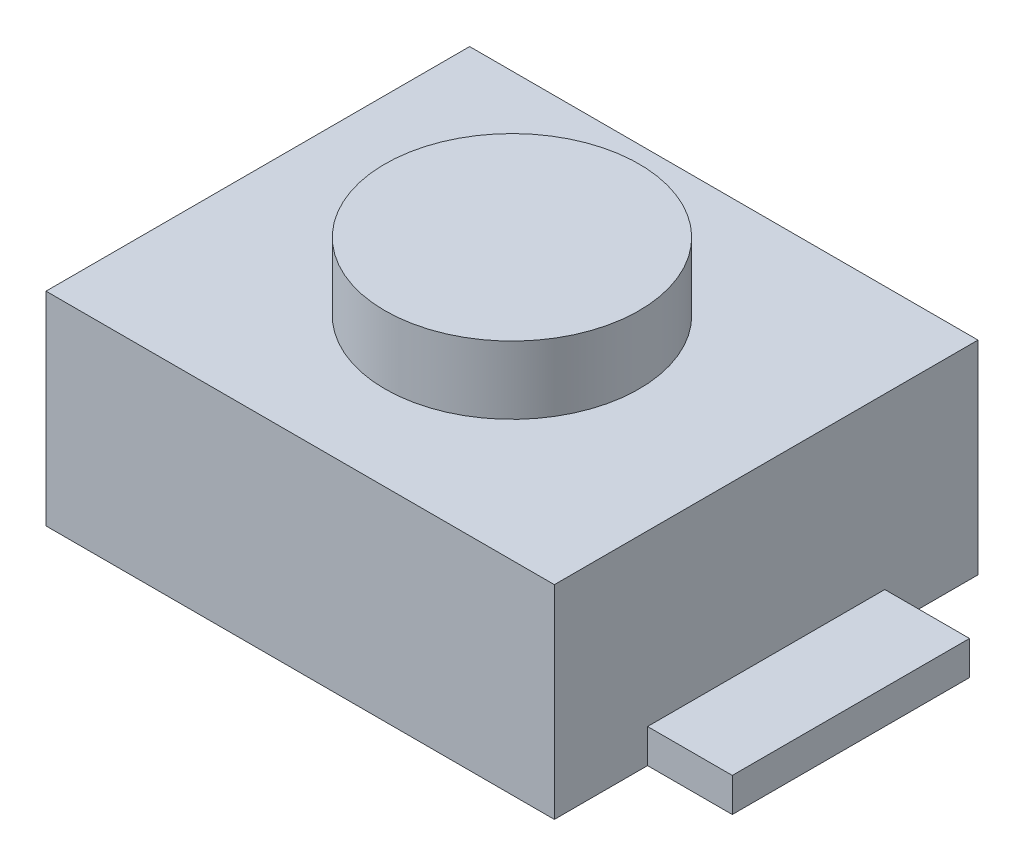
from build123d import *

# Parameters (mm, degrees)
SKETCH1_W           = 3
SKETCH1_H           = 2.5
BOSS_EXTRUDE1_DEPTH = 1.2
SKETCH2_W           = 1.4
SKETCH2_H           = 0.2
BOSS_EXTRUDE2_DEPTH = 0.5
SKETCH3_W           = 1.4
SKETCH3_H           = 0.2
BOSS_EXTRUDE3_DEPTH = 0.5
SKETCH4_W           = 0.75
SKETCH4_H           = 0.4


with BuildPart() as part:
    # Sketch1 → Boss-Extrude1 (new body)
    with BuildSketch(Plane.XZ):
        Rectangle(SKETCH1_W, SKETCH1_H)
    extrude(amount=-BOSS_EXTRUDE1_DEPTH)

    # Sketch2 → Boss-Extrude2 (add)
    with BuildSketch(Plane(origin=(1.5, 0, 0), x_dir=(0, 0, -1), z_dir=(1, 0, 0))):
        with Locations((0, 0.1)):
            Rectangle(SKETCH2_W, SKETCH2_H)
    extrude(amount=BOSS_EXTRUDE2_DEPTH)

    # Sketch3 → Boss-Extrude3 (add)
    with BuildSketch(Plane.ZY.offset(1.5)):
        with Locations((0, 0.1)):
            Rectangle(SKETCH3_W, SKETCH3_H)
    extrude(amount=BOSS_EXTRUDE3_DEPTH)

    # Sketch4 → Revolve1 (revolve)
    with BuildSketch(Plane(origin=(0, 0, 0), x_dir=(-1, 0, 0), z_dir=(0, 0, -1)), mode=Mode.PRIVATE) as revolve1_sk:
        with Locations((-0.375, 1.4)):
            Rectangle(SKETCH4_W, SKETCH4_H)
    revolve(revolve1_sk.sketch.rotate(Axis((0, 1.2, 0), (0, 1, 0)), 270), axis=Axis((0, 1.2, 0), (0, 1, 0)))


solid = part.part
